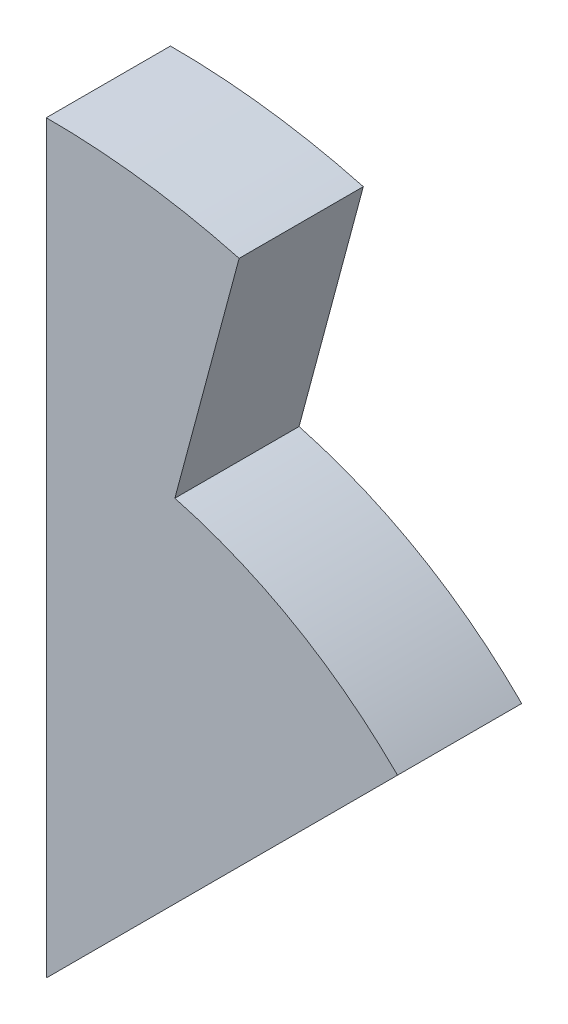
from build123d import *

# Parameters (mm, degrees)
AUFSATZ_LINEAR_AUSTRAGEN2_DEPTH = 5
SCHNITT_LINEAR_AUSTRAGEN2_DEPTH = 38.080992435


with BuildPart() as part:
    # Skizze1 → Aufsatz-Linear austragen2 (new body)
    with BuildSketch(Plane.XY):
        with BuildLine():
            Line((0, 0), (0, 30))
            ThreePointArc((0, 30), (11.480502971, 27.716385975), (21.213203436, 21.213203436))
            Line((21.213203436, 21.213203436), (0, 0))
        make_face()
    extrude(amount=AUFSATZ_LINEAR_AUSTRAGEN2_DEPTH)

    # Skizze2 → Schnitt-Linear austragen2 (cut, through all)
    with BuildSketch(Plane.XY.offset(5)):
        with BuildLine():
            Line((14.142135624, 14.142135624), (21.213203436, 21.213203436))
            ThreePointArc((21.213203436, 21.213203436), (15, 25.980762114), (7.764571353, 28.977774789))
            Line((7.764571353, 28.977774789), (5.176380902, 19.318516526))
            ThreePointArc((5.176380902, 19.318516526), (10, 17.320508076), (14.142135624, 14.142135624))
        make_face()
    extrude(amount=-SCHNITT_LINEAR_AUSTRAGEN2_DEPTH, mode=Mode.SUBTRACT)


solid = part.part
